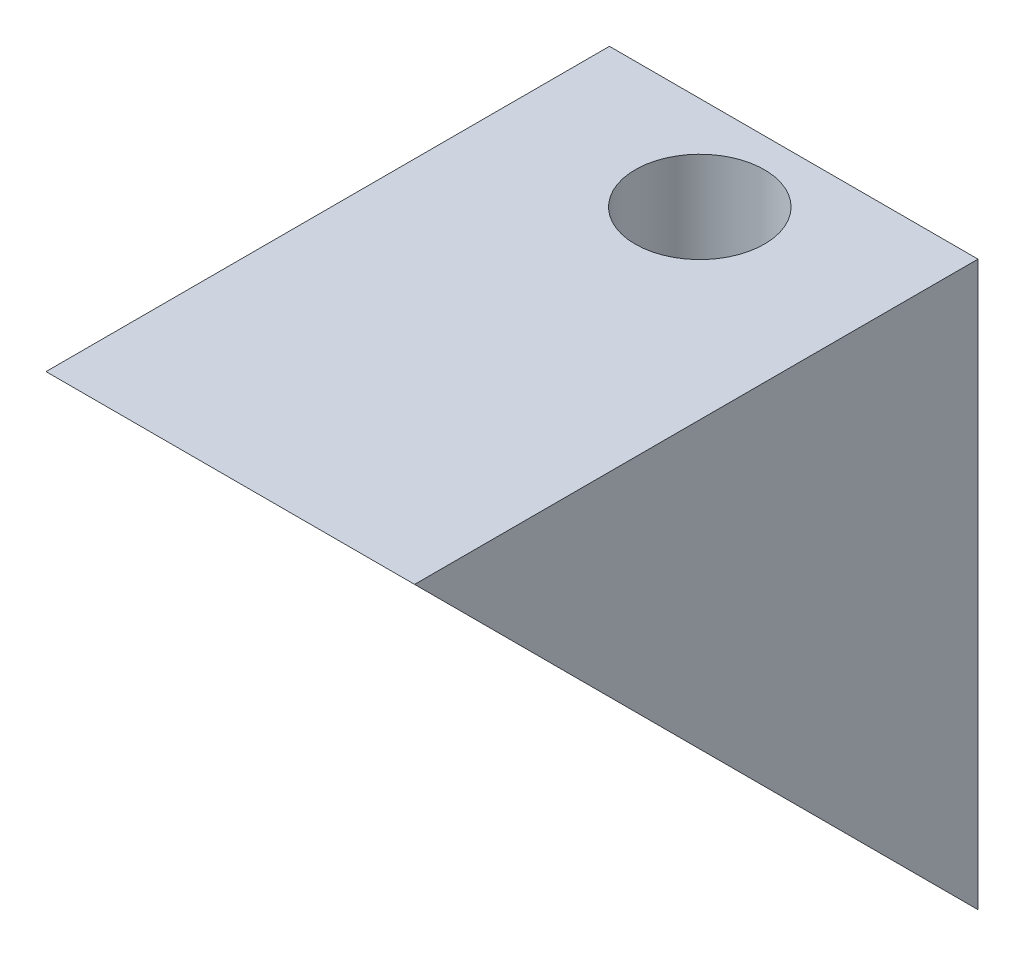
from build123d import *

# Parameters (mm, degrees)
BOSS_EXTRUDE1_DEPTH = 39.25
SKETCH4_R           = 13.75
CUT_EXTRUDE1_DEPTH  = 30
SKETCH7_R           = 9.5
SKETCH6_R           = 10.1
SKETCH5_R           = 3.5
CUT_EXTRUDE2_DEPTH  = 15


with BuildPart() as part:
    # Sketch2 → Boss-Extrude1 (new, symmetric)
    with BuildSketch(Plane(origin=(0, 0, 0), x_dir=(0, 0, -1), z_dir=(1, 0, 0))):
        Polygon((-100, -24.35604681), (20, -144.35604681), (20, -24.35604681), align=None)
    extrude(amount=BOSS_EXTRUDE1_DEPTH, both=True)

    # Sketch4 → Cut-Extrude1 (cut)
    with BuildSketch(Plane(origin=(0, -24.35604681, 0), x_dir=(1, 0, 0), z_dir=(0, 1, 0))):
        with Locations(Location((0, 0, 0), (0, 0, 270))):
            Circle(SKETCH4_R)
    extrude(amount=-CUT_EXTRUDE1_DEPTH, mode=Mode.SUBTRACT)

    # Sketch7 → Cut-Loft1 section 0
    with BuildSketch(Plane(origin=(0, -84.35604681, 0), x_dir=(1, 0, 0), z_dir=(0, 1, 0))):
        Circle(SKETCH7_R)
    # Sketch6 → Cut-Loft1 section 1
    with BuildSketch(Plane(origin=(0, -54.35604681, 0), x_dir=(1, 0, 0), z_dir=(0, 1, 0))):
        Circle(SKETCH6_R)
    loft(mode=Mode.SUBTRACT)

    # Sketch5 → Cut-Extrude2 (cut)
    with BuildSketch(Plane(origin=(0, 0, -20), x_dir=(-1, 0, 0), z_dir=(0, 0, -1))):
        with Locations(Location((0, -59.35604681, 0), (0, 0, 90))):
            Circle(SKETCH5_R)
        with Locations(Location((0, -74.35604681, 0), (0, 0, 90))):
            Circle(SKETCH5_R)
    extrude(amount=-CUT_EXTRUDE2_DEPTH, mode=Mode.SUBTRACT)


solid = part.part
